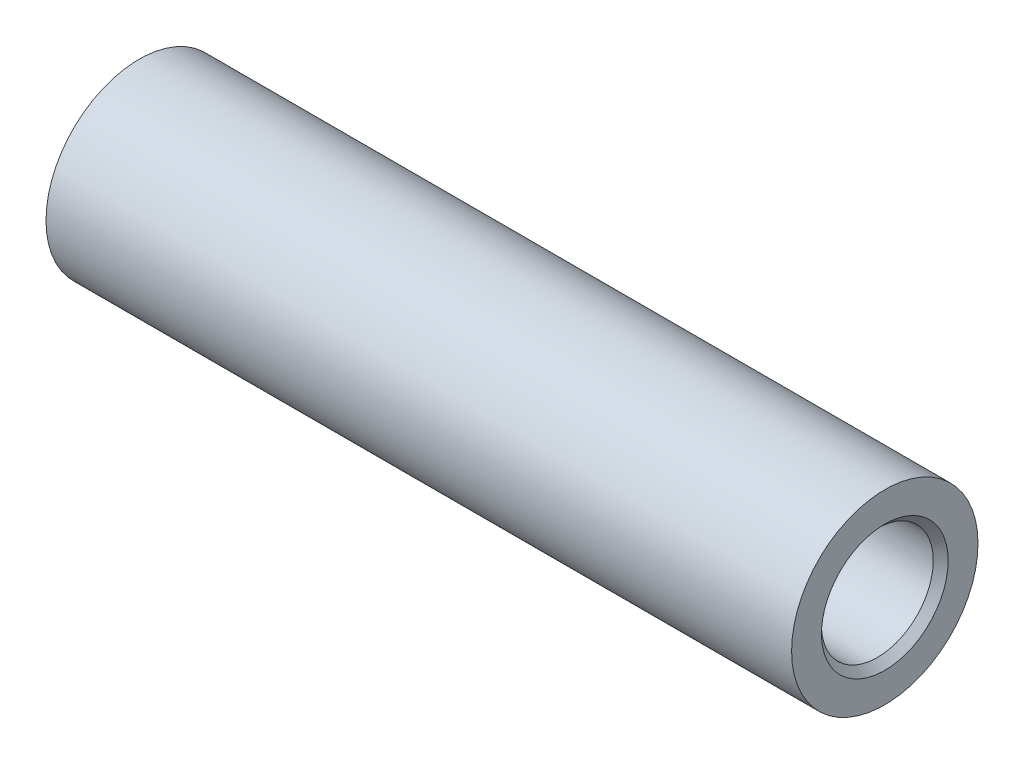
from build123d import *

# Parameters (mm, degrees)
EXTRUDE_1_DEPTH      = 19
EXTRUDE_1_DEPTH_BACK = 21
SKETCH_1_R           = 5
SKETCH_3_R           = 3
CUT_EXTRUDE_1_DEPTH  = 17
SKETCH_4_R           = 4
CUT_EXTRUDE_2_DEPTH  = 21
EXTRUDE_2_DEPTH      = 12
EXTRUDE_START        = 15
EXTRUDE_3_DEPTH      = 15
CHAMFER_1_SIZE       = 0.4
FILLET_1_R           = 0.4
FILLET_2_R           = 0.4


with BuildPart() as part:
    # 草图1 → 凸台-拉伸1 (new, two sides: drawn at the far end of the back side and taken through both)
    with BuildSketch(Plane(origin=(0, 0, 0), x_dir=(0, 0, -1), z_dir=(1, 0, 0)).offset(-EXTRUDE_1_DEPTH_BACK)):
        Circle(SKETCH_1_R)
    extrude(amount=EXTRUDE_1_DEPTH + EXTRUDE_1_DEPTH_BACK)

    # 草图3 → 切除-拉伸1 (cut)
    with BuildSketch(Plane(origin=(19, 0, 0), x_dir=(0, 0, -1), z_dir=(1, 0, 0))):
        Circle(SKETCH_3_R)
    extrude(amount=-CUT_EXTRUDE_1_DEPTH, mode=Mode.SUBTRACT)

    # 草图4 → 切除-拉伸2 (cut)
    with BuildSketch(Plane.ZY.offset(21)):
        Circle(SKETCH_4_R)
    extrude(amount=-CUT_EXTRUDE_2_DEPTH, mode=Mode.SUBTRACT)

    # 草图6 → 凸台-拉伸3 (add)
    with BuildSketch(Plane.ZY.offset(EXTRUDE_START)):
        with BuildLine():
            Line((-1.899540758, 3.520191033), (1.973227995, 3.479421113))
            ThreePointArc((1.973227995, 3.479421113), (0.042106993, 3.999778369), (-1.899540758, 3.520191033))
        make_face()
    extrude(amount=-EXTRUDE_3_DEPTH)

    # 倒角1
    chamfer_1_edges = [part.edges().sort_by_distance(p)[0] for p in [
        (-21, 0, -4),
        (19, 0, 3),
    ]]
    chamfer(chamfer_1_edges, length=CHAMFER_1_SIZE)

    # 圆角2
    fillet_2_edges = [part.edges().sort_by_distance(p)[0] for p in [
        (-15, 3.499806073, 0.036843619),
    ]]
    fillet(fillet_2_edges, radius=FILLET_2_R)


with BuildPart() as body_2:
    # 草图5 → 凸台-拉伸2 (new body)
    with BuildSketch(Plane(origin=(2, 0, 0), x_dir=(0, 0, -1), z_dir=(1, 0, 0))):
        with BuildLine():
            Line((-1.658312395, 2.5), (1.658312395, 2.5))
            ThreePointArc((1.658312395, 2.5), (0, 3), (-1.658312395, 2.5))
        make_face()
    extrude(amount=EXTRUDE_2_DEPTH)

    # 圆角1
    fillet_1_edges = [body_2.edges().sort_by_distance(p)[0] for p in [
        (14, 2.5, 0),
    ]]
    fillet(fillet_1_edges, radius=FILLET_1_R)


solid = Compound([part.part, body_2.part])
